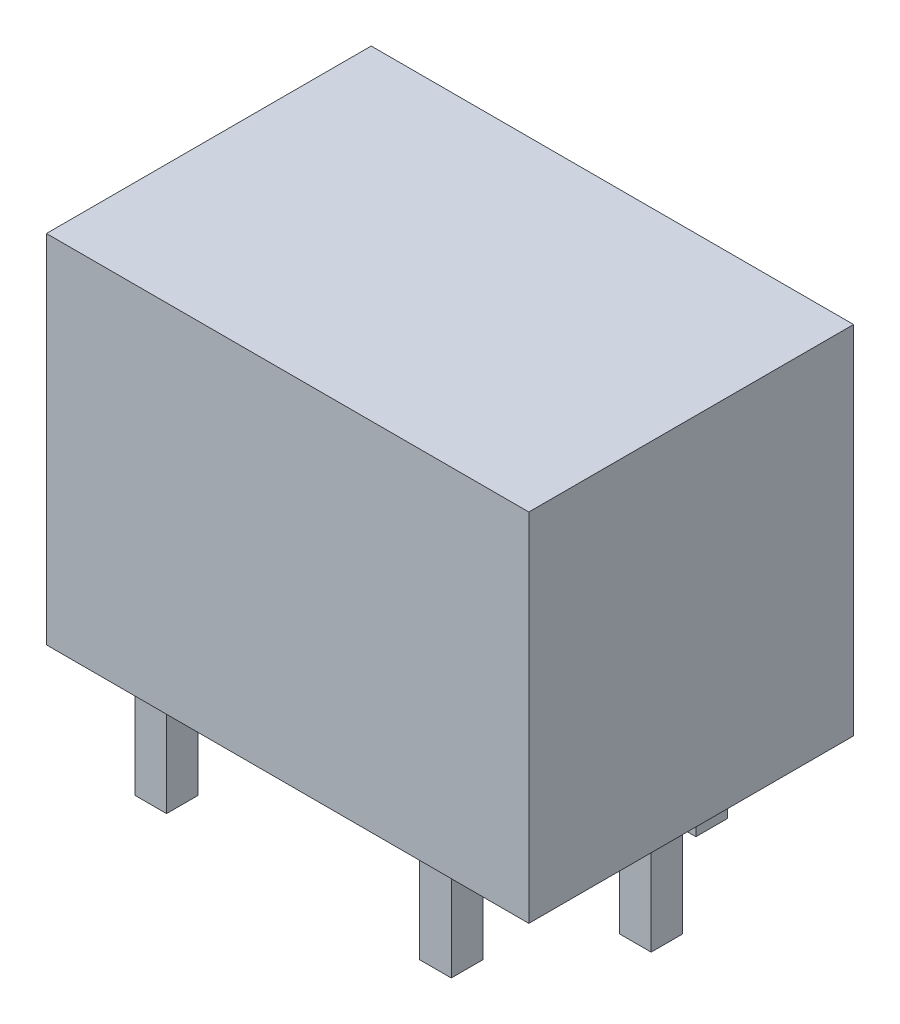
from build123d import *

# Parameters (mm, degrees)
SKETCH_1_W      = 15.3
SKETCH_1_H      = 10.3
EXTRUDE_1_DEPTH = 11.3
SKETCH_2_W      = 1
SKETCH_2_H      = 1
EXTRUDE_2_DEPTH = 3.5


with BuildPart() as part:
    # 草图1 → 拉伸1 (new body)
    with BuildSketch(Plane(origin=(0, 0, 0), x_dir=(1, 0, 0), z_dir=(0, 1, 0))):
        Rectangle(SKETCH_1_W, SKETCH_1_H)
    extrude(amount=EXTRUDE_1_DEPTH)

    # 草图2 → 拉伸2 (add)
    with BuildSketch(Plane.XZ):
        with Locations((6.38, 0)):
            Rectangle(SKETCH_2_W, SKETCH_2_H)
        with Locations((3.92, 3.88)):
            Rectangle(SKETCH_2_W, SKETCH_2_H)
        with Locations((-5.11, 3.88)):
            Rectangle(SKETCH_2_W, SKETCH_2_H)
        with Locations((-5.11, -3.88)):
            Rectangle(SKETCH_2_W, SKETCH_2_H)
        with Locations((3.92, -3.88)):
            Rectangle(SKETCH_2_W, SKETCH_2_H)
    extrude(amount=EXTRUDE_2_DEPTH)


solid = part.part
